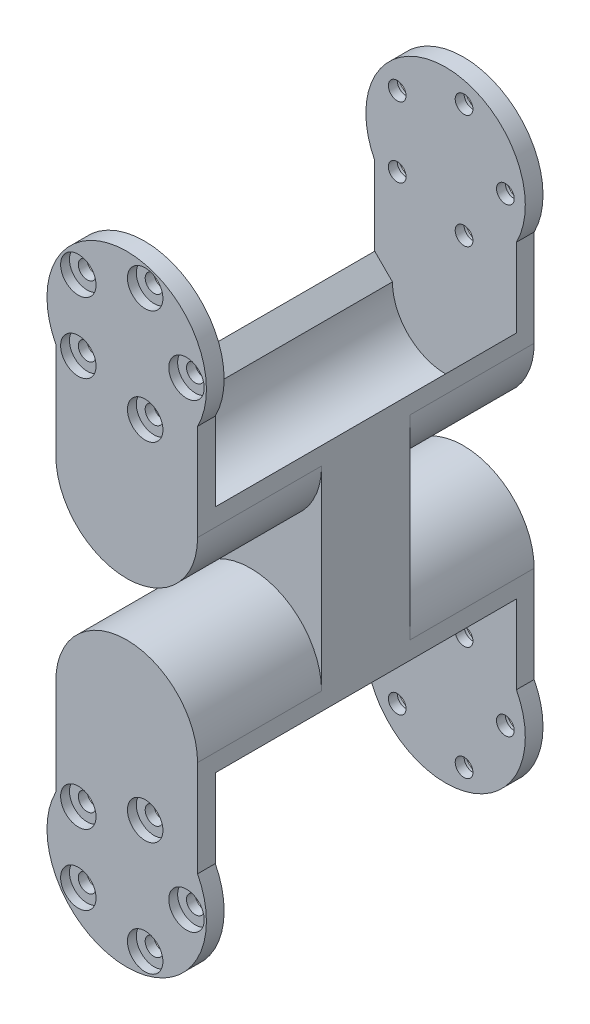
from build123d import *

# Parameters (mm, degrees)
BOSS_EXTRUDE2_DEPTH       = 4
BOSS_EXTRUDE3_START       = 68
BOSS_EXTRUDE3_DEPTH       = 68
BOSS_EXTRUDE4_START       = 4
BOSS_EXTRUDE4_DEPTH       = 4
BOSS_EXTRUDE5_START       = -4
BOSS_EXTRUDE5_DEPTH       = 4
CUT_EXTRUDE1_REACH        = 144.941
CUT_EXTRUDE2_DEPTH        = 143.940547082
BOSS_EXTRUDE7_DEPTH       = 10
BOSS_EXTRUDE7_DEPTH_BACK  = 10
SKETCH10_R                = 2
CUT_EXTRUDE3_DEPTH        = 4
SKETCH11_R                = 18
SKETCH11_R_2              = 16
BOSS_EXTRUDE8_DEPTH       = 4
MIRROR6_COPY_1_SKETCH_R   = 2
MIRROR6_COPY_1_DEPTH      = 4
MIRROR6_COPY_2_SKETCH_R   = 18
MIRROR6_COPY_2_SKETCH_R_2 = 16
MIRROR6_COPY_2_DEPTH      = 4
SKETCH12_R                = 4.000160783
SKETCH12_R_2              = 2
CUT_EXTRUDE5_DEPTH        = 2
MIRROR8_COPY_1_SKETCH_R   = 4.000160783
MIRROR8_COPY_1_SKETCH_R_2 = 2
MIRROR8_COPY_1_DEPTH      = 2
SKETCH13_W                = 4
SKETCH13_H                = 5
BOSS_EXTRUDE9_DEPTH       = 6
SKETCH14_W                = 20
SKETCH14_H                = 5
BOSS_EXTRUDE10_DEPTH      = 4
FILLET1_R                 = 5


with BuildPart() as part:
    # Sketch2 → Boss-Extrude2 (new body)
    with BuildSketch(Plane.XY):
        with BuildLine():
            Line((-16, 0), (-16, 30))
            ThreePointArc((-16, 30), (0, 46), (16, 30))
            Line((16, 30), (16, 0))
            ThreePointArc((16, 0), (0, -16), (-16, 0))
        make_face()
    extrude(amount=BOSS_EXTRUDE2_DEPTH)

    # Sketch3 → Boss-Extrude3 (add)
    with BuildSketch(Plane(origin=(0, 0, 0), x_dir=(-1, 0, 0), z_dir=(0, 0, -1)).offset(BOSS_EXTRUDE3_START)):
        with BuildLine():
            Line((-16, 30), (-16, 26))
            Line((-16, 26), (-12, 30))
            ThreePointArc((-12, 30), (0, 42), (12, 30))
            Line((12, 30), (16, 26))
            Line((16, 26), (16, 30))
            ThreePointArc((16, 30), (0, 46), (-16, 30))
        make_face()
    boss_extrude3 = extrude(amount=-BOSS_EXTRUDE3_DEPTH)

    # Sketch4 → Boss-Extrude4 (add)
    with BuildSketch(Plane(origin=(0, 0, -68), x_dir=(-1, 0, 0), z_dir=(0, 0, -1)).offset(BOSS_EXTRUDE4_START)):
        with BuildLine():
            Line((-16, 30), (-16, 0))
            ThreePointArc((-16, 0), (0, -16), (16, 0))
            Line((16, 0), (16, 30))
            ThreePointArc((16, 30), (0, 46), (-16, 30))
        make_face()
    boss_extrude4 = extrude(amount=-BOSS_EXTRUDE4_DEPTH)

    # Sketch5 → Boss-Extrude5 (add)
    with BuildSketch(Plane.XY.offset(4).offset(BOSS_EXTRUDE5_START)):
        with BuildLine():
            Line((-16, 120), (-16, 30))
            ThreePointArc((-16, 30), (0, 46), (16, 30))
            Line((16, 30), (16, 120))
            Line((16, 120), (-16, 120))
        make_face()
    boss_extrude5 = extrude(amount=BOSS_EXTRUDE5_DEPTH)

    # Mirror3: Boss-Extrude3, Boss-Extrude4 across plane
    add(boss_extrude3.mirror(Plane(origin=(0, 52, 0), x_dir=(0, 0, 1), z_dir=(0, -1, 0))))
    add(boss_extrude4.mirror(Plane(origin=(0, 52, 0), x_dir=(0, 0, 1), z_dir=(0, -1, 0))))

    # Sketch6 → Cut-Extrude1 (cut, up to next)
    with BuildSketch(Plane.XY.offset(4), mode=Mode.PRIVATE) as cut_extrude1_sk1:
        with BuildLine():
            ThreePointArc((-16, 104), (-11.313708499, 115.313708499), (0, 120))
            Line((0, 120), (-16, 120))
            Line((-16, 120), (-16, 104))
        make_face()
    cut_extrude1_tool1 = extrude(cut_extrude1_sk1.sketch, amount=-CUT_EXTRUDE1_REACH, mode=Mode.PRIVATE) & part.part
    # Sketch6 → Cut-Extrude1 (cut, up to next)
    with BuildSketch(Plane.XY.offset(4), mode=Mode.PRIVATE) as cut_extrude1_sk2:
        with BuildLine():
            Line((16, 104), (16, 120))
            Line((16, 120), (0, 120))
            ThreePointArc((0, 120), (11.313708499, 115.313708499), (16, 104))
        make_face()
    cut_extrude1_tool2 = extrude(cut_extrude1_sk2.sketch, amount=-CUT_EXTRUDE1_REACH, mode=Mode.PRIVATE) & part.part
    cut_extrude1_1 = cut_extrude1_tool1.solids().sort_by_distance((-12.426113, 116.426113, 4))[0]
    add(cut_extrude1_1, mode=Mode.SUBTRACT)
    cut_extrude1_2 = cut_extrude1_tool2.solids().sort_by_distance((12.426113, 116.426113, 4))[0]
    add(cut_extrude1_2, mode=Mode.SUBTRACT)
    cut_extrude1 = cut_extrude1_1 + cut_extrude1_2  # Cut-Extrude1 as one shape, for the pattern or mirror that repeats it

    # Mirror4: Boss-Extrude5, Cut-Extrude1 across plane
    add(boss_extrude5.mirror(Plane.XY.offset(-34)))
    add(cut_extrude1.mirror(Plane.XY.offset(-34)), mode=Mode.SUBTRACT)

    # Sketch8 → Cut-Extrude2 (cut, through all)
    with BuildSketch(Plane(origin=(0, 0, -72), x_dir=(-1, 0, 0), z_dir=(0, 0, -1))):
        with BuildLine():
            Line((-16, 74), (-16, 30))
            ThreePointArc((-16, 30), (0, 46), (16, 30))
            Line((16, 30), (16, 74))
            ThreePointArc((16, 74), (0, 58), (-16, 74))
        make_face()
    extrude(amount=-CUT_EXTRUDE2_DEPTH, mode=Mode.SUBTRACT)


with BuildPart() as cut_extrude2_piece_1:
    # of the separate pieces the step leaves, piece 1, a body of its own (cut_extrude2_pieces)
    add(part.part.solids().sort_by_distance((16, 104, 4))[0])



with BuildPart() as cut_extrude2_piece_2:
    # of the separate pieces the step leaves, piece 2, a body of its own (cut_extrude2_pieces)
    add(part.part.solids().sort_by_distance((16, 0, 0))[0])


with BuildPart() as cut_extrude2_piece_1_1:
    add(cut_extrude2_piece_1.part)

    add(cut_extrude2_piece_2.part)  # Boss-Extrude7 merges Cut-Extrude2 piece 2
    # Sketch9 → Boss-Extrude7 (add, two sides: drawn at the far end of the back side and taken through both)
    with BuildSketch(Plane.XY.offset(-34).offset(-BOSS_EXTRUDE7_DEPTH_BACK)):
        with BuildLine():
            Line((-16, 74), (-16, 30))
            ThreePointArc((-16, 30), (0, 46), (16, 30))
            Line((16, 30), (16, 74))
            ThreePointArc((16, 74), (0, 58), (-16, 74))
        make_face()
    extrude(amount=BOSS_EXTRUDE7_DEPTH + BOSS_EXTRUDE7_DEPTH_BACK)

    # Sketch10 → Cut-Extrude3 (cut)
    with BuildSketch(Plane(origin=(0, 0, -72), x_dir=(-1, 0, 0), z_dir=(0, 0, -1))):
        with Locations((-13.5, 0)):
            Circle(SKETCH10_R)
        with Locations((-4.171729424, 12.83926297)):
            Circle(SKETCH10_R)
        with Locations((10.921729424, 7.935100906)):
            Circle(SKETCH10_R)
        with Locations((10.921729424, -7.935100906)):
            Circle(SKETCH10_R)
        with Locations((-4.171729424, -12.83926297)):
            Circle(SKETCH10_R)
    cut_extrude3 = extrude(amount=-CUT_EXTRUDE3_DEPTH, mode=Mode.SUBTRACT)

    # Sketch11 → Boss-Extrude8 (add)
    with BuildSketch(Plane(origin=(0, 0, -72), x_dir=(-1, 0, 0), z_dir=(0, 0, -1))):
        Circle(SKETCH11_R)
        Circle(SKETCH11_R_2, mode=Mode.SUBTRACT)
    boss_extrude8 = extrude(amount=-BOSS_EXTRUDE8_DEPTH)

    # Mirror5: Cut-Extrude3, Boss-Extrude8 across plane
    add(cut_extrude3.mirror(Plane.XY.offset(-34)), mode=Mode.SUBTRACT)
    add(boss_extrude8.mirror(Plane.XY.offset(-34)))

    # Mirror6: Cut-Extrude3, Boss-Extrude8 across plane
    add(cut_extrude3.mirror(Plane(origin=(0, 52, 0), x_dir=(0, 0, 1), z_dir=(0, -1, 0))), mode=Mode.SUBTRACT)
    add(boss_extrude8.mirror(Plane(origin=(0, 52, 0), x_dir=(0, 0, 1), z_dir=(0, -1, 0))))

    # Mirror6 copy 1 sketch → Mirror6 copy 1 (cut)
    with BuildSketch(Plane(origin=(0, 104, 4), x_dir=(-1, 0, 0), z_dir=(0, 0, 1))):
        with Locations((-13.5, 0)):
            Circle(MIRROR6_COPY_1_SKETCH_R)
        with Locations((-4.171729424, 12.83926297)):
            Circle(MIRROR6_COPY_1_SKETCH_R)
        with Locations((10.921729424, 7.935100906)):
            Circle(MIRROR6_COPY_1_SKETCH_R)
        with Locations((10.921729424, -7.935100906)):
            Circle(MIRROR6_COPY_1_SKETCH_R)
        with Locations((-4.171729424, -12.83926297)):
            Circle(MIRROR6_COPY_1_SKETCH_R)
    extrude(amount=-MIRROR6_COPY_1_DEPTH, mode=Mode.SUBTRACT)

    # Mirror6 copy 2 sketch → Mirror6 copy 2 (add)
    with BuildSketch(Plane(origin=(0, 104, 4), x_dir=(-1, 0, 0), z_dir=(0, 0, 1))):
        Circle(MIRROR6_COPY_2_SKETCH_R)
        Circle(MIRROR6_COPY_2_SKETCH_R_2, mode=Mode.SUBTRACT)
    extrude(amount=-MIRROR6_COPY_2_DEPTH)

    # Sketch12 → Cut-Extrude5 (cut)
    # profile 1 of 5: a face of its own
    with BuildSketch(Plane.XY.offset(4)):
        with Locations((-10.921729424, 7.935100906)):
            Circle(SKETCH12_R)
        with Locations((-10.921729424, 7.935100906)):
            Circle(SKETCH12_R_2, mode=Mode.SUBTRACT)
    # profile 2 of 5: a face of its own
    with BuildSketch(Plane.XY.offset(4)):
        with Locations((4.171729424, 12.83926297)):
            Circle(SKETCH12_R)
        with Locations((4.171729424, 12.83926297)):
            Circle(SKETCH12_R_2, mode=Mode.SUBTRACT)
    # profile 3 of 5: a face of its own
    with BuildSketch(Plane.XY.offset(4)):
        with Locations((13.5, 0)):
            Circle(SKETCH12_R)
        with Locations((13.5, 0)):
            Circle(SKETCH12_R_2, mode=Mode.SUBTRACT)
    # profile 4 of 5: a face of its own
    with BuildSketch(Plane.XY.offset(4)):
        with Locations((4.171729424, -12.83926297)):
            Circle(SKETCH12_R)
        with Locations((4.171729424, -12.83926297)):
            Circle(SKETCH12_R_2, mode=Mode.SUBTRACT)
    # profile 5 of 5: a face of its own
    with BuildSketch(Plane.XY.offset(4)):
        with Locations((-10.921729424, -7.935100906)):
            Circle(SKETCH12_R)
        with Locations((-10.921729424, -7.935100906)):
            Circle(SKETCH12_R_2, mode=Mode.SUBTRACT)
    cut_extrude5 = extrude(amount=-CUT_EXTRUDE5_DEPTH, mode=Mode.SUBTRACT)

    # Mirror7: Cut-Extrude5 across plane
    add(cut_extrude5.mirror(Plane.XY.offset(-34)), mode=Mode.SUBTRACT)

    # Mirror8: Cut-Extrude5 across plane
    add(cut_extrude5.mirror(Plane(origin=(0, 52, 0), x_dir=(0, 0, 1), z_dir=(0, -1, 0))), mode=Mode.SUBTRACT)

    # Mirror8 copy 1 sketch → Mirror8 copy 1 (cut)
    # profile 1 of 5: a face of its own
    with BuildSketch(Plane(origin=(0, 104, -72), x_dir=(1, 0, 0), z_dir=(0, 0, -1))):
        with Locations((-10.921729424, 7.935100906)):
            Circle(MIRROR8_COPY_1_SKETCH_R)
        with Locations((-10.921729424, 7.935100906)):
            Circle(MIRROR8_COPY_1_SKETCH_R_2, mode=Mode.SUBTRACT)
    # profile 2 of 5: a face of its own
    with BuildSketch(Plane(origin=(0, 104, -72), x_dir=(1, 0, 0), z_dir=(0, 0, -1))):
        with Locations((4.171729424, 12.83926297)):
            Circle(MIRROR8_COPY_1_SKETCH_R)
        with Locations((4.171729424, 12.83926297)):
            Circle(MIRROR8_COPY_1_SKETCH_R_2, mode=Mode.SUBTRACT)
    # profile 3 of 5: a face of its own
    with BuildSketch(Plane(origin=(0, 104, -72), x_dir=(1, 0, 0), z_dir=(0, 0, -1))):
        with Locations((13.5, 0)):
            Circle(MIRROR8_COPY_1_SKETCH_R)
        with Locations((13.5, 0)):
            Circle(MIRROR8_COPY_1_SKETCH_R_2, mode=Mode.SUBTRACT)
    # profile 4 of 5: a face of its own
    with BuildSketch(Plane(origin=(0, 104, -72), x_dir=(1, 0, 0), z_dir=(0, 0, -1))):
        with Locations((4.171729424, -12.83926297)):
            Circle(MIRROR8_COPY_1_SKETCH_R)
        with Locations((4.171729424, -12.83926297)):
            Circle(MIRROR8_COPY_1_SKETCH_R_2, mode=Mode.SUBTRACT)
    # profile 5 of 5: a face of its own
    with BuildSketch(Plane(origin=(0, 104, -72), x_dir=(1, 0, 0), z_dir=(0, 0, -1))):
        with Locations((-10.921729424, -7.935100906)):
            Circle(MIRROR8_COPY_1_SKETCH_R)
        with Locations((-10.921729424, -7.935100906)):
            Circle(MIRROR8_COPY_1_SKETCH_R_2, mode=Mode.SUBTRACT)
    extrude(amount=-MIRROR8_COPY_1_DEPTH, mode=Mode.SUBTRACT)

    # Sketch13 → Boss-Extrude9 (add)
    with BuildSketch(Plane.ZY.offset(16)):
        with Locations((-42, 52)):
            Rectangle(SKETCH13_W, SKETCH13_H)
        with Locations((-26, 52)):
            Rectangle(SKETCH13_W, SKETCH13_H)
    extrude(amount=BOSS_EXTRUDE9_DEPTH)

    # Sketch14 → Boss-Extrude10 (add)
    with BuildSketch(Plane.ZY.offset(22)):
        with Locations((-34, 52)):
            Rectangle(SKETCH14_W, SKETCH14_H)
    extrude(amount=BOSS_EXTRUDE10_DEPTH)

    # Fillet1
    fillet1_edges = [cut_extrude2_piece_1_1.edges().sort_by_distance(p)[0] for p in [
        (-26, 52, -44),
        (-26, 52, -24),
    ]]
    fillet(fillet1_edges, radius=FILLET1_R)


solid = cut_extrude2_piece_1_1.part
